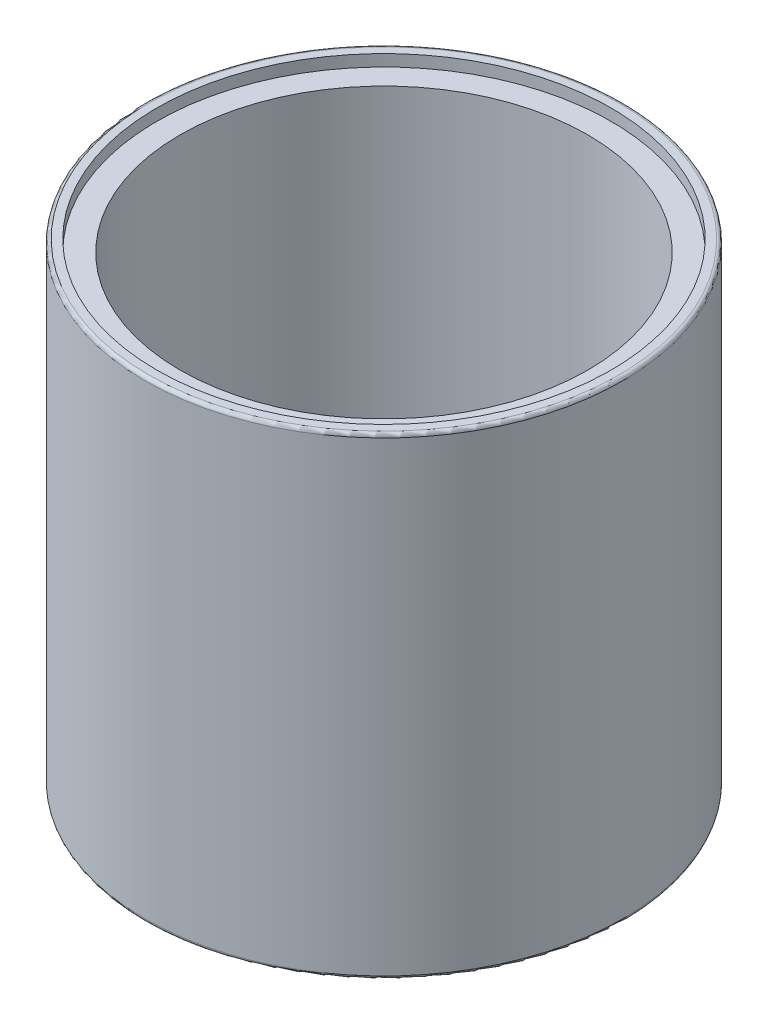
from build123d import *


with BuildPart() as part:
    # Sketch1 → Revolve1 (revolve)
    with BuildSketch(Plane.XY, mode=Mode.PRIVATE) as revolve1_sk:
        with BuildLine():
            Line((35, 38.6), (35, -38.6))
            Line((35, -38.6), (36.501758704, -38.6))
            Line((36.501758704, -38.6), (36.501758704, -41.241333322))
            Line((36.501758704, -41.241333322), (38.197365936, -41.241333322))
            Line((38.197365936, -41.241333322), (38.197365936, -38.6))
            Line((38.197365936, -38.6), (39, -38.6))
            Line((39, -38.6), (39, -40.6))
            Line((39, -40.6), (40.4, -40.6))
            ThreePointArc((40.4, -40.6), (40.824264069, -40.424264069), (41, -40))
            Line((41, -40), (41, 40))
            ThreePointArc((41, 40), (40.824264069, 40.424264069), (40.4, 40.6))
            Line((40.4, 40.6), (39, 40.6))
            Line((39, 40.6), (39, 38.6))
            Line((39, 38.6), (35, 38.6))
        make_face()
    revolve(revolve1_sk.sketch.rotate(Axis((0, 62.3869405, 0), (0, -1, 0)), 90), axis=Axis((0, 62.3869405, 0), (0, -1, 0)))


solid = part.part
